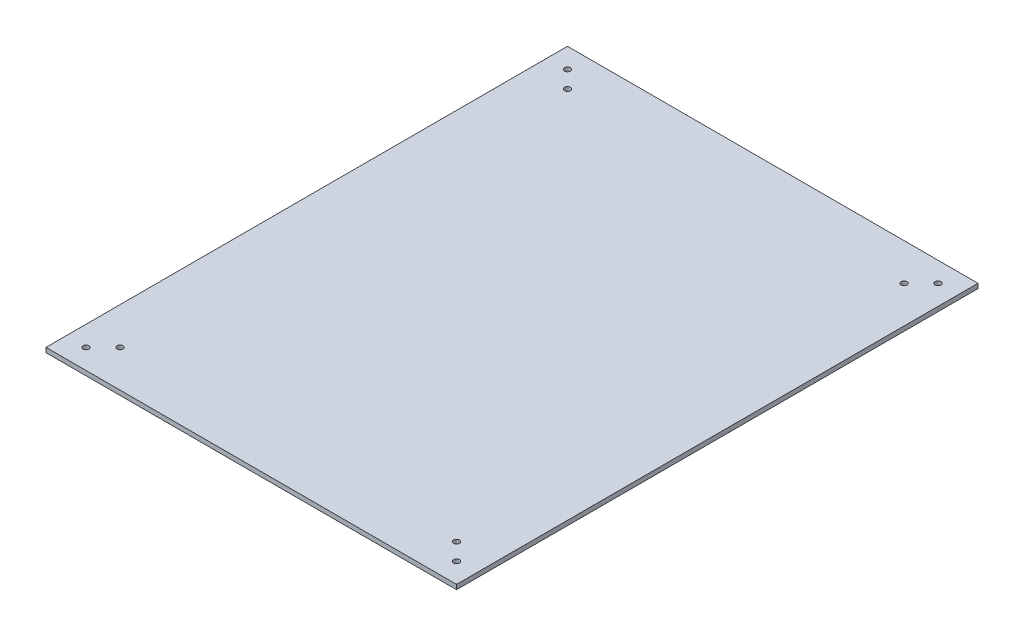
from build123d import *

# Parameters (mm, degrees)
SKETCH1_W           = 222
SKETCH1_H           = 282
SKETCH1_R           = 1.6
BOSS_EXTRUDE1_DEPTH = 2.5


with BuildPart() as part:
    # Sketch1 → Boss-Extrude1 (new body)
    with BuildSketch(Plane(origin=(0, 0, 0), x_dir=(1, 0, 0), z_dir=(0, 1, 0))):
        Rectangle(SKETCH1_W, SKETCH1_H)
        with Locations(Location((-100.181980515, 130.181980515, 0), (0, 0, 270))):
            Circle(SKETCH1_R, mode=Mode.SUBTRACT)
        with Locations(Location((100.181980515, 130.181980515, 0), (0, 0, 270))):
            Circle(SKETCH1_R, mode=Mode.SUBTRACT)
        with Locations(Location((-100.181980515, -130.181980515, 0), (0, 0, 270))):
            Circle(SKETCH1_R, mode=Mode.SUBTRACT)
        with Locations(Location((100.181980515, -130.181980515, 0), (0, 0, 270))):
            Circle(SKETCH1_R, mode=Mode.SUBTRACT)
        with Locations(Location((-91, 121, 0), (0, 0, 270))):
            Circle(SKETCH1_R, mode=Mode.SUBTRACT)
        with Locations(Location((91, 121, 0), (0, 0, 270))):
            Circle(SKETCH1_R, mode=Mode.SUBTRACT)
        with Locations(Location((-91, -121, 0), (0, 0, 270))):
            Circle(SKETCH1_R, mode=Mode.SUBTRACT)
        with Locations(Location((91, -121, 0), (0, 0, 270))):
            Circle(SKETCH1_R, mode=Mode.SUBTRACT)
    extrude(amount=BOSS_EXTRUDE1_DEPTH)


solid = part.part
